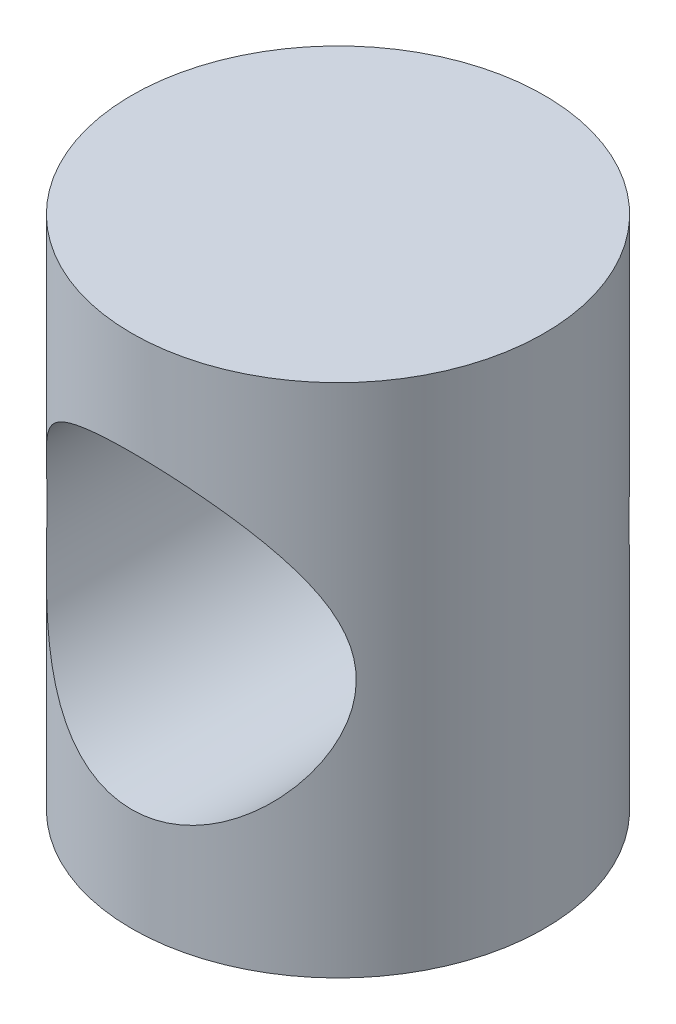
from build123d import *
from build123d.topology import SkipClean

# Parameters (mm, degrees)
SKETCH_1_W           = 4
SKETCH_1_H           = 4
EXTRUDE_2_DEPTH      = 5
SKETCH_3_R           = 1.5
CUT_EXTRUDE_2_DEPTH  = 7.708203932
CUT_EXTRUDE_14_DEPTH = 6.744562647


with BuildPart() as part:
    # 草图1 → 凸台-拉伸2 (new body)
    with BuildSketch(Plane(origin=(0, 0, 0), x_dir=(1, 0, 0), z_dir=(0, 1, 0))):
        Rectangle(SKETCH_1_W, SKETCH_1_H)
    extrude(amount=EXTRUDE_2_DEPTH)

    # 草图3 → 切除-拉伸2 (cut, through all)
    with BuildSketch(Plane.XY.offset(2)):
        with Locations((0, 2.5)):
            Circle(SKETCH_3_R)
    extrude(amount=-CUT_EXTRUDE_2_DEPTH, mode=Mode.SUBTRACT)

    # 草图6 → 切除-拉伸14 (cut, through all)
    with SkipClean():  # the faces are left unmerged after this step: merging them gives an invalid solid
        with BuildSketch(Plane(origin=(0, 5, 0), x_dir=(1, 0, 0), z_dir=(0, 1, 0))):
            with BuildLine():
                Line((-2, 2), (-2, 0))
                ThreePointArc((-2, 0), (-1.414213562, 1.414213562), (0, 2))
                Line((0, 2), (-2, 2))
            make_face()
            with BuildLine():
                ThreePointArc((0, 2), (1.414213562, 1.414213562), (2, 0))
                Line((2, 0), (2, 2))
                Line((2, 2), (0, 2))
            make_face()
            with BuildLine():
                Line((0, -2), (2, -2))
                Line((2, -2), (2, 0))
                ThreePointArc((2, 0), (1.414213562, -1.414213562), (0, -2))
            make_face()
            with BuildLine():
                Line((-2, -2), (0, -2))
                ThreePointArc((0, -2), (-1.414213562, -1.414213562), (-2, 0))
                Line((-2, 0), (-2, -2))
            make_face()
        extrude(amount=-CUT_EXTRUDE_14_DEPTH, mode=Mode.SUBTRACT)


solid = part.part
